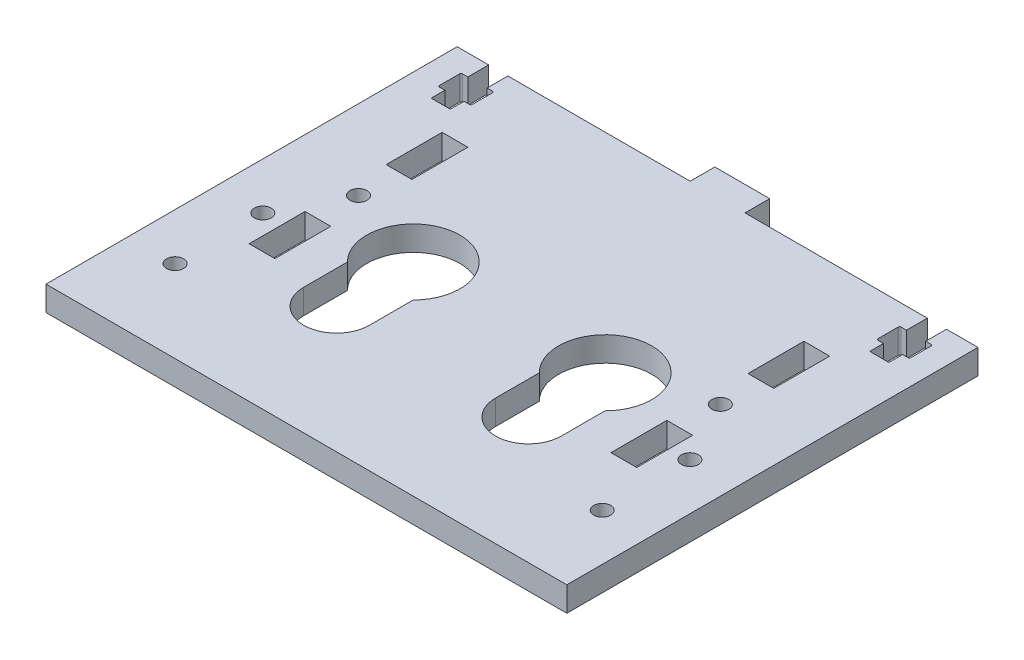
from build123d import *

# Parameters (mm, degrees)
SKETCH1_W          = 95
SKETCH1_H          = 75
MAINSHAPE_DEPTH    = 4.5
SKETCH2_W          = 10
SKETCH2_H          = 9
TAB1_DEPTH         = 4.5
CUT_EXTRUDE2_DEPTH = 64.564927436
SKETCH5_R          = 1.55
SKETCH5_W          = 4.7
SKETCH5_H          = 10.2
CUT_EXTRUDE3_DEPTH = 64.564927436
CUT_EXTRUDE4_DEPTH = 64.564927436
SKETCH8_R          = 1.55
CUT_EXTRUDE6_DEPTH = 64.564927436


with BuildPart() as part:
    # Sketch1 → MainShape (new body)
    with BuildSketch(Plane(origin=(0, 0, 0), x_dir=(1, 0, 0), z_dir=(0, 1, 0))):
        Rectangle(SKETCH1_W, SKETCH1_H)
    extrude(amount=MAINSHAPE_DEPTH)

    # Sketch2 → Tab1 (add, through all)
    with BuildSketch(Plane(origin=(0, 4.5, 0), x_dir=(1, 0, 0), z_dir=(0, 1, 0))):
        with Locations((0, 37.5)):
            Rectangle(SKETCH2_W, SKETCH2_H)
    extrude(amount=-TAB1_DEPTH)

    # Sketch4 → Cut-Extrude2 (cut, through all)
    with BuildSketch(Plane(origin=(0, 4.5, 0), x_dir=(1, 0, 0), z_dir=(0, 1, 0))):
        with BuildLine():
            Line((-38.25, 27), (-41.75, 27))
            Line((-41.75, 27), (-41.75, 29.5))
            Line((-41.75, 29.5), (-42.75, 29.5))
            ThreePointArc((-42.75, 29.5), (-42.926776695, 29.573223305), (-43, 29.75))
            Line((-43, 29.75), (-43, 33.45))
            ThreePointArc((-43, 33.45), (-42.926776695, 33.626776695), (-42.75, 33.7))
            Line((-42.75, 33.7), (-41.75, 33.7))
            Line((-41.75, 33.7), (-41.75, 37.5))
            Line((-41.75, 37.5), (-38.25, 37.5))
            Line((-38.25, 37.5), (-38.25, 33.7))
            Line((-38.25, 33.7), (-37.25, 33.7))
            ThreePointArc((-37.25, 33.7), (-37.073223305, 33.626776695), (-37, 33.45))
            Line((-37, 33.45), (-37, 29.75))
            ThreePointArc((-37, 29.75), (-37.073223305, 29.573223305), (-37.25, 29.5))
            Line((-37.25, 29.5), (-38.25, 29.5))
            Line((-38.25, 29.5), (-38.25, 27))
        make_face()
        with BuildLine():
            Line((38.25, 27), (38.25, 29.5))
            Line((38.25, 29.5), (37.25, 29.5))
            ThreePointArc((37.25, 29.5), (37.073223305, 29.573223305), (37, 29.75))
            Line((37, 29.75), (37, 33.45))
            ThreePointArc((37, 33.45), (37.073223305, 33.626776695), (37.25, 33.7))
            Line((37.25, 33.7), (38.25, 33.7))
            Line((38.25, 33.7), (38.25, 37.5))
            Line((38.25, 37.5), (41.75, 37.5))
            Line((41.75, 37.5), (41.75, 33.7))
            Line((41.75, 33.7), (42.75, 33.7))
            ThreePointArc((42.75, 33.7), (42.926776695, 33.626776695), (43, 33.45))
            Line((43, 33.45), (43, 29.75))
            ThreePointArc((43, 29.75), (42.926776695, 29.573223305), (42.75, 29.5))
            Line((42.75, 29.5), (41.75, 29.5))
            Line((41.75, 29.5), (41.75, 27))
            Line((41.75, 27), (38.25, 27))
        make_face()
    extrude(amount=-CUT_EXTRUDE2_DEPTH, mode=Mode.SUBTRACT)

    # Sketch5 → Cut-Extrude3 (cut, through all)
    with BuildSketch(Plane(origin=(0, 4.5, 0), x_dir=(1, 0, 0), z_dir=(0, 1, 0))):
        with Locations(Location((33, 5, 0), (0, 0, 270))):
            Circle(SKETCH5_R)
        with Locations(Location((-33, 5, 0), (0, 0, 90))):
            Circle(SKETCH5_R)
        with Locations((33, 17.5)):
            Rectangle(SKETCH5_W, SKETCH5_H)
        with Locations((-33, 17.5)):
            Rectangle(SKETCH5_W, SKETCH5_H)
        with Locations((-33, -7.5)):
            Rectangle(SKETCH5_W, SKETCH5_H)
        with Locations((33, -7.5)):
            Rectangle(SKETCH5_W, SKETCH5_H)
    extrude(amount=-CUT_EXTRUDE3_DEPTH, mode=Mode.SUBTRACT)

    # Sketch6 → Cut-Extrude4 (cut, through all)
    with BuildSketch(Plane(origin=(0, 4.5, 0), x_dir=(1, 0, 0), z_dir=(0, 1, 0))):
        with BuildLine():
            Line((-23.5, -14.5), (-23.5, -6.520797289))
            ThreePointArc((-23.5, -6.520797289), (-17.5, 8), (-11.5, -6.520797289))
            Line((-11.5, -6.520797289), (-11.5, -14.5))
            ThreePointArc((-11.5, -14.5), (-17.5, -20.5), (-23.5, -14.5))
        make_face()
    cut_extrude4 = extrude(amount=-CUT_EXTRUDE4_DEPTH, mode=Mode.SUBTRACT)

    # Sketch8 → Cut-Extrude6 (cut, through all)
    with BuildSketch(Plane(origin=(0, 4.5, 0), x_dir=(1, 0, 0), z_dir=(0, 1, 0))):
        with Locations(Location((-38.96, -6.5, 0), (0, 0, 270))):
            Circle(SKETCH8_R)
        with Locations(Location((-38.96, -22.5, 0), (0, 0, 90))):
            Circle(SKETCH8_R)
    cut_extrude6 = extrude(amount=-CUT_EXTRUDE6_DEPTH, mode=Mode.SUBTRACT)

    # Mirror1: Cut-Extrude4, Cut-Extrude6 across plane
    add(cut_extrude4.mirror(Plane(origin=(0, 0, 0), x_dir=(0, 0, 1), z_dir=(1, 0, 0))), mode=Mode.SUBTRACT)
    add(cut_extrude6.mirror(Plane(origin=(0, 0, 0), x_dir=(0, 0, 1), z_dir=(1, 0, 0))), mode=Mode.SUBTRACT)


solid = part.part
